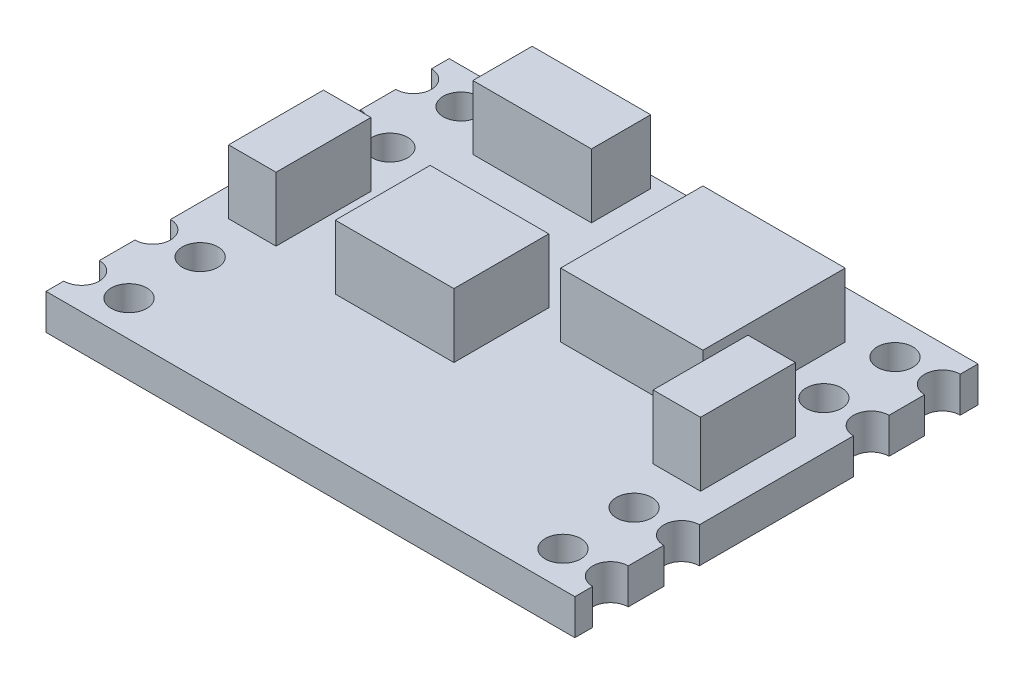
from build123d import *

# Parameters (mm, degrees)
SKETCH_1_W          = 22.3
SKETCH_1_H          = 17
EXTRUDE_1_DEPTH     = 1.5
SKETCH_2_W          = 6
SKETCH_2_H          = 6
SKETCH_2_W_2        = 5
SKETCH_2_H_2        = 2.5
SKETCH_2_W_3        = 2
SKETCH_2_H_3        = 4
EXTRUDE_2_DEPTH     = 2.7
SKETCH_3_R          = 0.75
CUT_EXTRUDE_1_DEPTH = 15.278042583


with BuildPart() as part:
    # 스케치1 → 보스-돌출1 (new body)
    with BuildSketch(Plane(origin=(0, 0, 0), x_dir=(1, 0, 0), z_dir=(0, 1, 0))):
        Rectangle(SKETCH_1_W, SKETCH_1_H)
    extrude(amount=EXTRUDE_1_DEPTH)

    # 스케치2 → 보스-돌출2 (add)
    with BuildSketch(Plane(origin=(0, 1.5, 0), x_dir=(1, 0, 0), z_dir=(0, 1, 0))):
        with Locations((4.55, 3.5)):
            Rectangle(SKETCH_2_W, SKETCH_2_H)
        with Locations((-4.65, 6.75)):
            Rectangle(SKETCH_2_W_2, SKETCH_2_H_2)
        with Locations((-8.95, 0)):
            Rectangle(SKETCH_2_W_3, SKETCH_2_H_3)
        with Locations((8.95, 0)):
            Rectangle(SKETCH_2_W_3, SKETCH_2_H_3)
        with Locations((-2.45, -0.5)):
            Rectangle(SKETCH_2_W_2, SKETCH_2_H_3)
    extrude(amount=EXTRUDE_2_DEPTH)

    # 스케치3 → 컷-돌출1 (cut, through all)
    with BuildSketch(Plane(origin=(0, 1.5, 0), x_dir=(1, 0, 0), z_dir=(0, 1, 0))):
        with Locations((-11.15, 7)):
            Circle(SKETCH_3_R)
        with Locations((-11.15, 4)):
            Circle(SKETCH_3_R)
        with Locations(Location((-9.15, 7, 0), (0, 0, 270))):
            Circle(SKETCH_3_R)
        with Locations(Location((-9.15, 4, 0), (0, 0, 270))):
            Circle(SKETCH_3_R)
        with Locations(Location((9.15, 7, 0), (0, 0, 270))):
            Circle(SKETCH_3_R)
        with Locations((11.15, 7)):
            Circle(SKETCH_3_R)
        with Locations(Location((9.15, 4, 0), (0, 0, 270))):
            Circle(SKETCH_3_R)
        with Locations((11.15, 4)):
            Circle(SKETCH_3_R)
        with Locations((-11.15, -4)):
            Circle(SKETCH_3_R)
        with Locations(Location((-9.15, -4, 0), (0, 0, 270))):
            Circle(SKETCH_3_R)
        with Locations(Location((-9.15, -7, 0), (0, 0, 270))):
            Circle(SKETCH_3_R)
        with Locations((-11.15, -7)):
            Circle(SKETCH_3_R)
        with Locations((11.15, -4)):
            Circle(SKETCH_3_R)
        with Locations(Location((9.15, -4, 0), (0, 0, 270))):
            Circle(SKETCH_3_R)
        with Locations(Location((9.15, -7, 0), (0, 0, 270))):
            Circle(SKETCH_3_R)
        with Locations((11.15, -7)):
            Circle(SKETCH_3_R)
    extrude(amount=-CUT_EXTRUDE_1_DEPTH, mode=Mode.SUBTRACT)


solid = part.part
